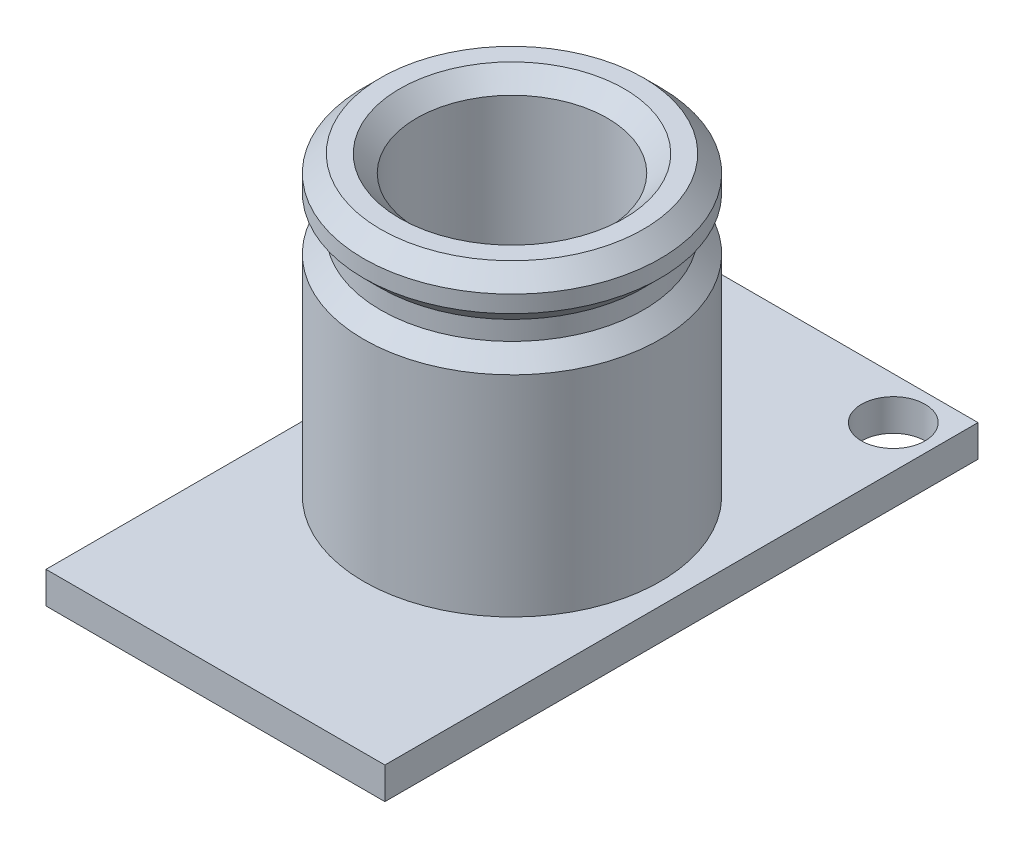
from build123d import *

# Parameters (mm, degrees)
SKETCH1_W           = 16
SKETCH1_H           = 28
BOSS_EXTRUDE1_DEPTH = 1.5
SKETCH5_R           = 1.5
CUT_EXTRUDE2_DEPTH  = 17.194134741
SKETCH2_R           = 7
BOSS_EXTRUDE2_DEPTH = 14
CHAMFER1_SIZE       = 0.8
SKETCH4_R           = 4.5
CUT_EXTRUDE1_DEPTH  = 8
CHAMFER2_SIZE       = 0.8


with BuildPart() as part:
    # Sketch1 → Boss-Extrude1 (new body)
    with BuildSketch(Plane(origin=(0, 0, 0), x_dir=(1, 0, 0), z_dir=(0, 1, 0))):
        Rectangle(SKETCH1_W, SKETCH1_H)
    extrude(amount=BOSS_EXTRUDE1_DEPTH)

    # Sketch5 → Cut-Extrude2 (cut, through all)
    with BuildSketch(Plane(origin=(0, 1.5, 0), x_dir=(1, 0, 0), z_dir=(0, 1, 0))):
        with Locations(Location((-6, 12, 0), (0, 0, 270))):
            Circle(SKETCH5_R)
    cut_extrude2 = extrude(amount=-CUT_EXTRUDE2_DEPTH, mode=Mode.SUBTRACT)

    # Mirror1: Cut-Extrude2 across plane
    add(cut_extrude2.mirror(Plane(origin=(0, 0, 0), x_dir=(0, 0, 1), z_dir=(1, 0, 0))), mode=Mode.SUBTRACT)


with BuildPart() as body_2:
    # Sketch2 → Boss-Extrude2 (new body)
    with BuildSketch(Plane(origin=(0, 1.5, 0), x_dir=(1, 0, 0), z_dir=(0, 1, 0))):
        with Locations(Location((0, 0, 0), (0, 0, 270))):
            Circle(SKETCH2_R)
    extrude(amount=BOSS_EXTRUDE2_DEPTH)

    # Chamfer1
    chamfer1_edges = [body_2.edges().sort_by_distance(p)[0] for p in [
        (0, 15.5, -7),
    ]]
    chamfer(chamfer1_edges, length=CHAMFER1_SIZE)

    # Sketch3 → Cut-Revolve1 (revolve, cut)
    with BuildSketch(Plane(origin=(0, 0, 0), x_dir=(0, 0, -1), z_dir=(1, 0, 0))):
        Polygon((7, 13.9), (6.2, 13.1), (6.2, 12.2), (7, 11.4), align=None)
    revolve(axis=Axis((0, -1000, 0), (0, 1, 0)), mode=Mode.SUBTRACT)

    # Sketch4 → Cut-Extrude1 (cut)
    with BuildSketch(Plane(origin=(0, 15.5, 0), x_dir=(1, 0, 0), z_dir=(0, 1, 0))):
        with Locations(Location((0, 0, 0), (0, 0, 270))):
            Circle(SKETCH4_R)
    extrude(amount=-CUT_EXTRUDE1_DEPTH, mode=Mode.SUBTRACT)

    # Chamfer2
    chamfer2_edges = [body_2.edges().sort_by_distance(p)[0] for p in [
        (0, 15.5, -4.5),
    ]]
    chamfer(chamfer2_edges, length=CHAMFER2_SIZE)


solid = Compound([part.part, body_2.part])
